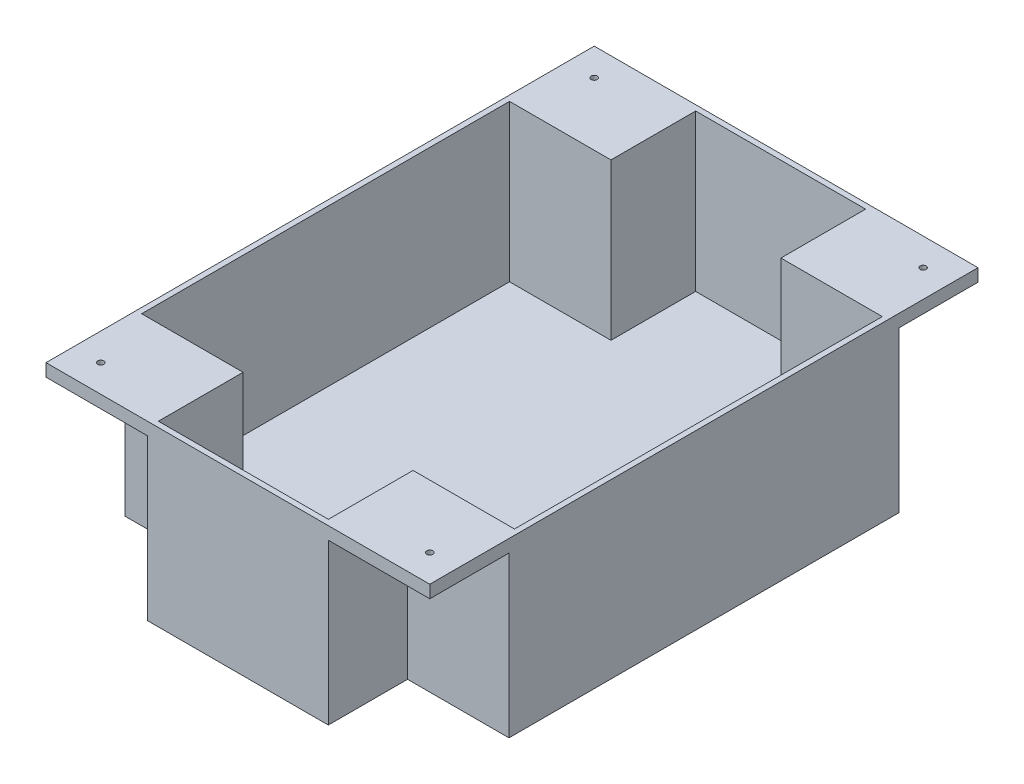
from build123d import *

# Parameters (mm, degrees)
CROQUIS1_W              = 70
CROQUIS1_H              = 100
SALIENTE_EXTRUIR1_DEPTH = 3
CROQUIS2_W              = 70
CROQUIS2_H              = 100
SALIENTE_EXTRUIR2_DEPTH = 28.5
CROQUIS3_R              = 0.56
CORTAR_EXTRUIR1_DEPTH   = 69.682239334
CROQUIS4_W              = 18.5
CROQUIS4_H              = 14.45
CORTAR_EXTRUIR2_DEPTH   = 29.2


with BuildPart() as part:
    # Croquis1 → Saliente-Extruir1 (new body)
    with BuildSketch(Plane(origin=(0, 0, 0), x_dir=(1, 0, 0), z_dir=(0, 1, 0))):
        Rectangle(CROQUIS1_W, CROQUIS1_H)
    extrude(amount=SALIENTE_EXTRUIR1_DEPTH)

    # Croquis2 → Saliente-Extruir2 (add)
    with BuildSketch(Plane(origin=(0, 3, 0), x_dir=(1, 0, 0), z_dir=(0, 1, 0))):
        Rectangle(CROQUIS2_W, CROQUIS2_H)
        Polygon((-34, 33.55), (-15.5, 33.55), (-15.5, 49), (15.5, 49), (15.5, 33.55), (34, 33.55), (34, -33.55), (15.5, -33.55), (15.5, -49), (-15.5, -49), (-15.5, -33.55), (-34, -33.55), align=None, mode=Mode.SUBTRACT)
    extrude(amount=SALIENTE_EXTRUIR2_DEPTH)

    # Croquis3 → Cortar-Extruir1 (cut, through all)
    with BuildSketch(Plane.XZ):
        with Locations(Location((-30, -45, 0), (0, 0, 270))):
            Circle(CROQUIS3_R)
        with Locations(Location((-30, 45, 0), (0, 0, 90))):
            Circle(CROQUIS3_R)
        with Locations(Location((30, -45, 0), (0, 0, 90))):
            Circle(CROQUIS3_R)
        with Locations(Location((30, 45, 0), (0, 0, 270))):
            Circle(CROQUIS3_R)
    extrude(amount=-CORTAR_EXTRUIR1_DEPTH, mode=Mode.SUBTRACT)

    # Croquis4 → Cortar-Extruir2 (cut)
    with BuildSketch(Plane.XZ):
        with Locations((-25.75, 42.775)):
            Rectangle(CROQUIS4_W, CROQUIS4_H)
        with Locations((25.75, 42.775)):
            Rectangle(CROQUIS4_W, CROQUIS4_H)
        with Locations((25.75, -42.775)):
            Rectangle(CROQUIS4_W, CROQUIS4_H)
        with Locations((-25.75, -42.775)):
            Rectangle(CROQUIS4_W, CROQUIS4_H)
    extrude(amount=-CORTAR_EXTRUIR2_DEPTH, mode=Mode.SUBTRACT)


solid = part.part
